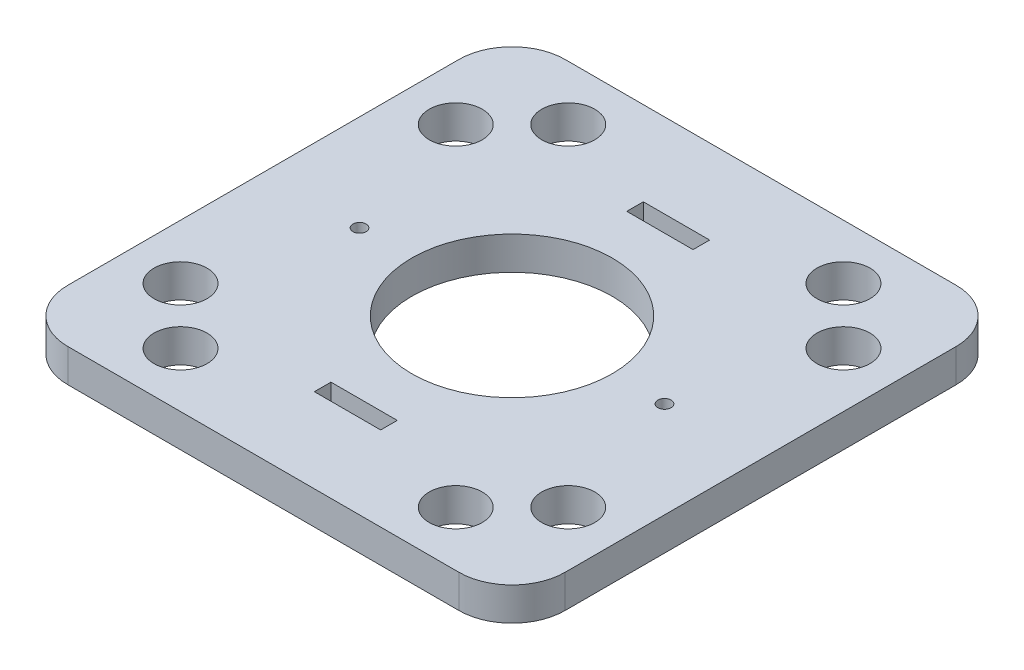
from build123d import *

# Parameters (mm, degrees)
SKETCH2_W           = 75
SKETCH2_H           = 75
SKETCH2_R           = 15.119722523
SKETCH2_R_2         = 1
SKETCH2_R_3         = 4
SKETCH2_W_2         = 10
SKETCH2_H_2         = 2.5
BOSS_EXTRUDE2_DEPTH = 5
FILLET1_R           = 8


with BuildPart() as part:
    # Sketch2 → Boss-Extrude2 (new body)
    with BuildSketch(Plane(origin=(0, 0, 0), x_dir=(1, 0, 0), z_dir=(0, 1, 0))):
        Rectangle(SKETCH2_W, SKETCH2_H)
        with Locations(Location((0, 0, 0), (0, 0, 270))):
            Circle(SKETCH2_R, mode=Mode.SUBTRACT)
        with Locations(Location((-23, 0, 0), (0, 0, 270))):
            Circle(SKETCH2_R_2, mode=Mode.SUBTRACT)
        with Locations(Location((23, 0, 0), (0, 0, 90))):
            Circle(SKETCH2_R_2, mode=Mode.SUBTRACT)
        with Locations(Location((29.242640687, 20.757359313, 0), (0, 0, 270))):
            Circle(SKETCH2_R_3, mode=Mode.SUBTRACT)
        with Locations(Location((20.757359313, 29.242640687, 0), (0, 0, 90))):
            Circle(SKETCH2_R_3, mode=Mode.SUBTRACT)
        with Locations(Location((-20.757359313, -29.242640687, 0), (0, 0, 90))):
            Circle(SKETCH2_R_3, mode=Mode.SUBTRACT)
        with Locations(Location((-29.242640687, -20.757359313, 0), (0, 0, 270))):
            Circle(SKETCH2_R_3, mode=Mode.SUBTRACT)
        with Locations(Location((-20.757359313, 29.242640687, 0), (0, 0, 270))):
            Circle(SKETCH2_R_3, mode=Mode.SUBTRACT)
        with Locations(Location((-29.242640687, 20.757359313, 0), (0, 0, 90))):
            Circle(SKETCH2_R_3, mode=Mode.SUBTRACT)
        with Locations(Location((29.242640687, -20.757359313, 0), (0, 0, 90))):
            Circle(SKETCH2_R_3, mode=Mode.SUBTRACT)
        with Locations(Location((20.757359313, -29.242640687, 0), (0, 0, 270))):
            Circle(SKETCH2_R_3, mode=Mode.SUBTRACT)
        with Locations((0, -23.559960871)):
            Rectangle(SKETCH2_W_2, SKETCH2_H_2, mode=Mode.SUBTRACT)
        with Locations((0, 23.559960871)):
            Rectangle(SKETCH2_W_2, SKETCH2_H_2, mode=Mode.SUBTRACT)
    extrude(amount=BOSS_EXTRUDE2_DEPTH)

    # Fillet1
    fillet1_edges = [part.edges().sort_by_distance(p)[0] for p in [
        (37.5, 2.5, 37.5),
        (-37.5, 2.5, 37.5),
        (-37.5, 2.5, -37.5),
        (37.5, 2.5, -37.5),
    ]]
    fillet(fillet1_edges, radius=FILLET1_R)


solid = part.part
